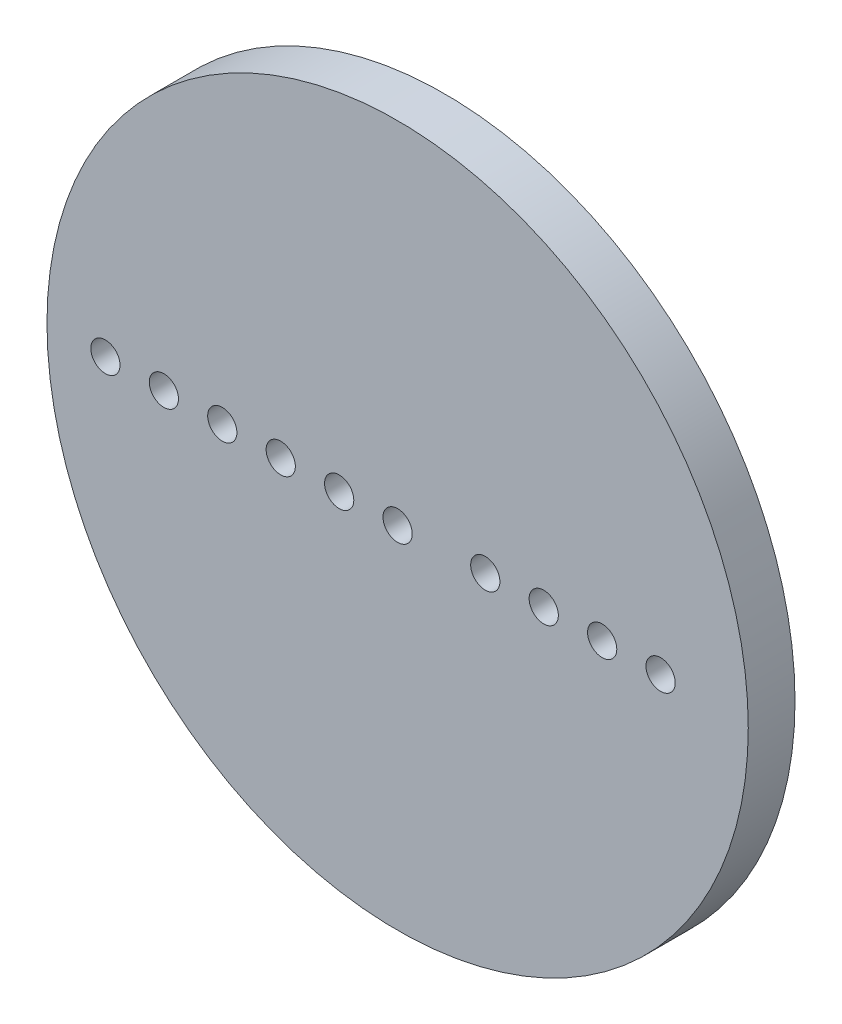
from build123d import *

# Parameters (mm, degrees)
SKETCH1_R           = 60
SKETCH1_R_2         = 2.5
BOSS_EXTRUDE1_DEPTH = 4


with BuildPart() as part:
    # Sketch1 → Boss-Extrude1 (new, symmetric)
    with BuildSketch(Plane.XY):
        Circle(SKETCH1_R)
        Circle(SKETCH1_R_2, mode=Mode.SUBTRACT)
        with Locations((-10, 0)):
            Circle(SKETCH1_R_2, mode=Mode.SUBTRACT)
        with Locations((-20, 0)):
            Circle(SKETCH1_R_2, mode=Mode.SUBTRACT)
        with Locations((-30, 0)):
            Circle(SKETCH1_R_2, mode=Mode.SUBTRACT)
        with Locations((-40, 0)):
            Circle(SKETCH1_R_2, mode=Mode.SUBTRACT)
        with Locations((-50, 0)):
            Circle(SKETCH1_R_2, mode=Mode.SUBTRACT)
        with Locations((45, 0.419447228)):
            Circle(SKETCH1_R_2, mode=Mode.SUBTRACT)
        with Locations((35, 0.419447228)):
            Circle(SKETCH1_R_2, mode=Mode.SUBTRACT)
        with Locations((25, 0.419447228)):
            Circle(SKETCH1_R_2, mode=Mode.SUBTRACT)
        with Locations((15, 0.419447228)):
            Circle(SKETCH1_R_2, mode=Mode.SUBTRACT)
    extrude(amount=BOSS_EXTRUDE1_DEPTH, both=True)


solid = part.part
